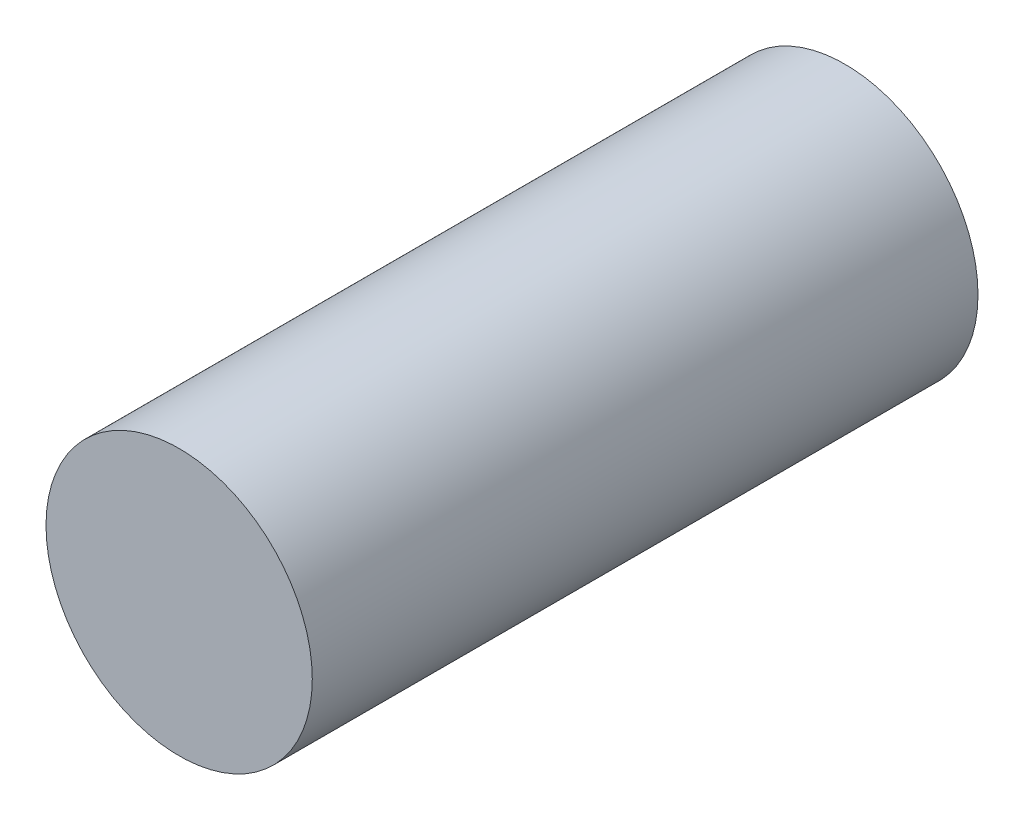
from build123d import *

# Parameters (mm, degrees)
SKETCH1_R           = 4
BOSS_EXTRUDE1_DEPTH = 20


with BuildPart() as part:
    # Sketch1 → Boss-Extrude1 (new body)
    with BuildSketch(Plane.XY):
        with Locations((-36.861518938, 18.474434255)):
            Circle(SKETCH1_R)
    extrude(amount=BOSS_EXTRUDE1_DEPTH)


solid = part.part
